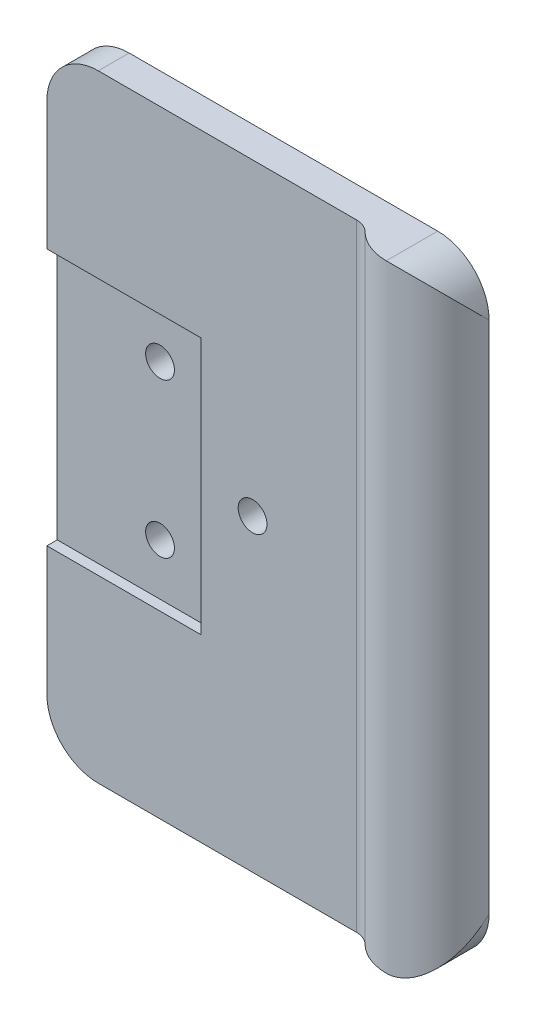
from build123d import *

# Parameters (mm, degrees)
SKETCH1_W                  = 40
SKETCH1_H                  = 60
BOSS_EXTRUDE1_DEPTH        = 3
SKETCH2_W                  = 15
SKETCH2_H                  = 25
CUT_EXTRUDE1_DEPTH         = 1
F_2_8_2_8_DIAMETER_HOLE1_D = 2.8
F_2_8_2_8_DIAMETER_HOLE2_D = 2.8
FILLET1_R                  = 5
BOSS_EXTRUDE2_DEPTH        = 36.5
CUT_EXTRUDE3_DEPTH         = 126
CUT_EXTRUDE4_START         = -126
SKETCH11_W                 = 58.073467033
SKETCH11_H                 = 92.384025597
CUT_EXTRUDE4_DEPTH         = 126
FILLET2_R                  = 2


with BuildPart() as part:
    # Sketch1 → Boss-Extrude1 (new body)
    with BuildSketch(Plane(origin=(0, 0, -3), x_dir=(-1, 0, 0), z_dir=(0, 0, -1))):
        with Locations((45.9850693, -3.193565597)):
            Rectangle(SKETCH1_W, SKETCH1_H)
    extrude(amount=-BOSS_EXTRUDE1_DEPTH)

    # Sketch2 → Cut-Extrude1 (cut)
    with BuildSketch(Plane.XY):
        with Locations((-58.4850693, -3.193565597)):
            Rectangle(SKETCH2_W, SKETCH2_H)
    extrude(amount=-CUT_EXTRUDE1_DEPTH, mode=Mode.SUBTRACT)

    # Ø2.8 (2.8) Diameter Hole1 (through all)
    with Locations(Plane.XY):
        with Locations((-45.9850693, -3.193565597)):
            Hole(F_2_8_2_8_DIAMETER_HOLE1_D / 2)

    # Ø2.8 (2.8) Diameter Hole2 (through all)
    with Locations(Plane.XY.offset(-1)):
        with Locations((-55.9850693, 4.306434403), (-55.9850693, -10.693565597)):
            Hole(F_2_8_2_8_DIAMETER_HOLE2_D / 2)

    # Fillet1
    fillet1_edges = [part.edges().sort_by_distance(p)[0] for p in [
        (-65.9850693, 26.806434403, -1.5),
        (-65.9850693, -33.193565597, -1.5),
        (-25.9850693, 26.806434403, -1.5),
        (-25.9850693, -33.193565597, -1.5),
    ]]
    fillet(fillet1_edges, radius=FILLET1_R)

    # Sketch8 → Boss-Extrude2 (add, symmetric)
    with BuildSketch(Plane(origin=(0, 0, 0), x_dir=(1, 0, 0), z_dir=(0, 1, 0))):
        with BuildLine():
            Line((-35.9850693, 3), (-25.9850693, 3))
            ThreePointArc((-25.9850693, 3), (-30.9850693, -2), (-35.9850693, 3))
        make_face()
    extrude(amount=BOSS_EXTRUDE2_DEPTH, both=True)

    # Sketch10 → Cut-Extrude3 (cut)
    with BuildSketch(Plane(origin=(0, 26.806434403, 0), x_dir=(1, 0, 0), z_dir=(0, 1, 0))):
        with BuildLine():
            Line((-26.9850693, 0), (-25.9850693, 0))
            Line((-25.9850693, 0), (-25.9850693, 3))
            ThreePointArc((-25.9850693, 3), (-26.24165281, 1.41886117), (-26.9850693, 0))
        make_face()
    extrude(amount=-CUT_EXTRUDE3_DEPTH, mode=Mode.SUBTRACT)

    # Sketch11 → Cut-Extrude4 (cut)
    with BuildSketch(Plane(origin=(0, 0, -3), x_dir=(-1, 0, 0), z_dir=(0, 0, -1)).offset(CUT_EXTRUDE4_START)):
        with Locations((44.104932563, -0.297791146)):
            Rectangle(SKETCH11_W, SKETCH11_H)
        with BuildLine():
            Line((35.9850693, -33.193565597), (60.9850693, -33.193565597))
            ThreePointArc((60.9850693, -33.193565597), (64.520603206, -31.729099503), (65.9850693, -28.193565597))
            Line((65.9850693, -28.193565597), (65.9850693, 21.806434403))
            ThreePointArc((65.9850693, 21.806434403), (64.520603206, 25.341968309), (60.9850693, 26.806434403))
            Line((60.9850693, 26.806434403), (35.9850693, 26.806434403))
            Line((35.9850693, 26.806434403), (30.9850693, 26.806434403))
            ThreePointArc((30.9850693, 26.806434403), (27.449535394, 25.341968309), (25.9850693, 21.806434403))
            Line((25.9850693, 21.806434403), (25.9850693, -28.193565597))
            ThreePointArc((25.9850693, -28.193565597), (27.449535394, -31.729099503), (30.9850693, -33.193565597))
            Line((30.9850693, -33.193565597), (35.9850693, -33.193565597))
        make_face(mode=Mode.SUBTRACT)
    extrude(amount=CUT_EXTRUDE4_DEPTH, mode=Mode.SUBTRACT)

    # Fillet2
    fillet2_edges = [part.edges().sort_by_distance(p)[0] for p in [
        (-34.9850693, -3.193565597, 0),
    ]]
    fillet(fillet2_edges, radius=FILLET2_R)


solid = part.part
